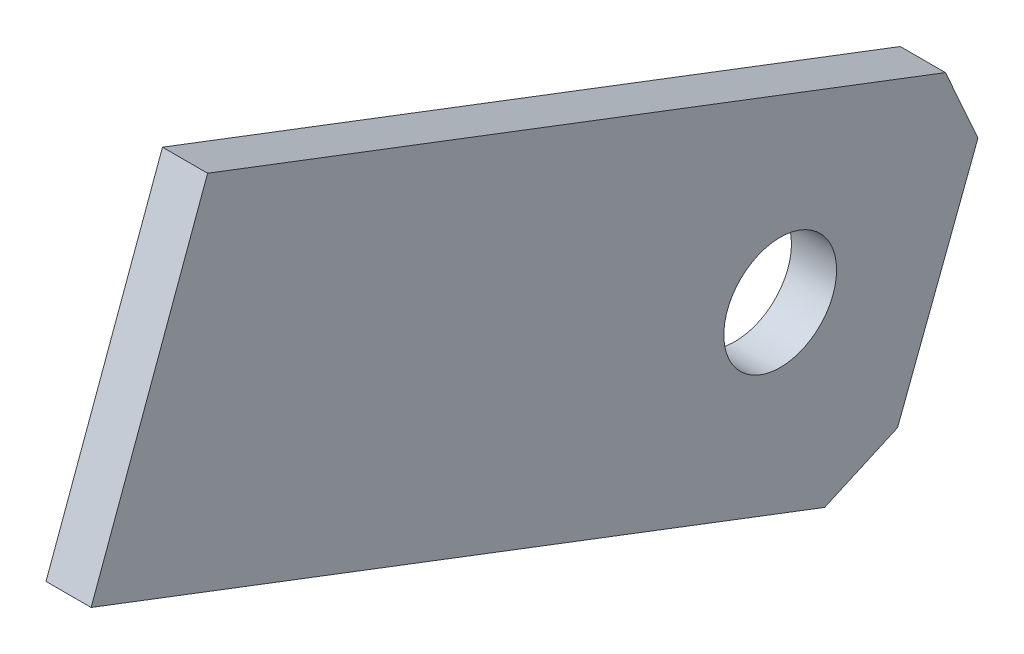
from build123d import *

# Parameters (mm, degrees)
BOSS_EXTRUDE1_DEPTH  = 4
M8_CLEARANCE_HOLE1_D = 9.999053744
CHAMFER1_SIZE        = 5


with BuildPart() as part:
    # Sketch1 → Boss-Extrude1 (new body)
    with BuildSketch(Plane(origin=(0.900000083, 0, 0), x_dir=(0, -1, 0), z_dir=(-1, 0, 0))):
        Polygon((-360.573996926, 1589.166586834), (-332.547614774, 1599.868077547), (-359.157201755, 1669.556541862), (-387.327723707, 1659.232542214), align=None)
    extrude(amount=-BOSS_EXTRUDE1_DEPTH)

    # M8 Clearance Hole1 (through all)
    with Locations(Plane(origin=(4.900000083, 0, 0), x_dir=(0, 0, -1), z_dir=(1, 0, 0))):
        with Locations((-1608.483107892, 352.03572843)):
            Hole(M8_CLEARANCE_HOLE1_D / 2)

    # Chamfer1
    chamfer1_edges = [part.edges().sort_by_distance(p)[0] for p in [
        (2.900000083, 332.547614774, 1599.868077547),
        (2.900000083, 360.573996926, 1589.166586834),
    ]]
    chamfer(chamfer1_edges, length=CHAMFER1_SIZE)


solid = part.part
